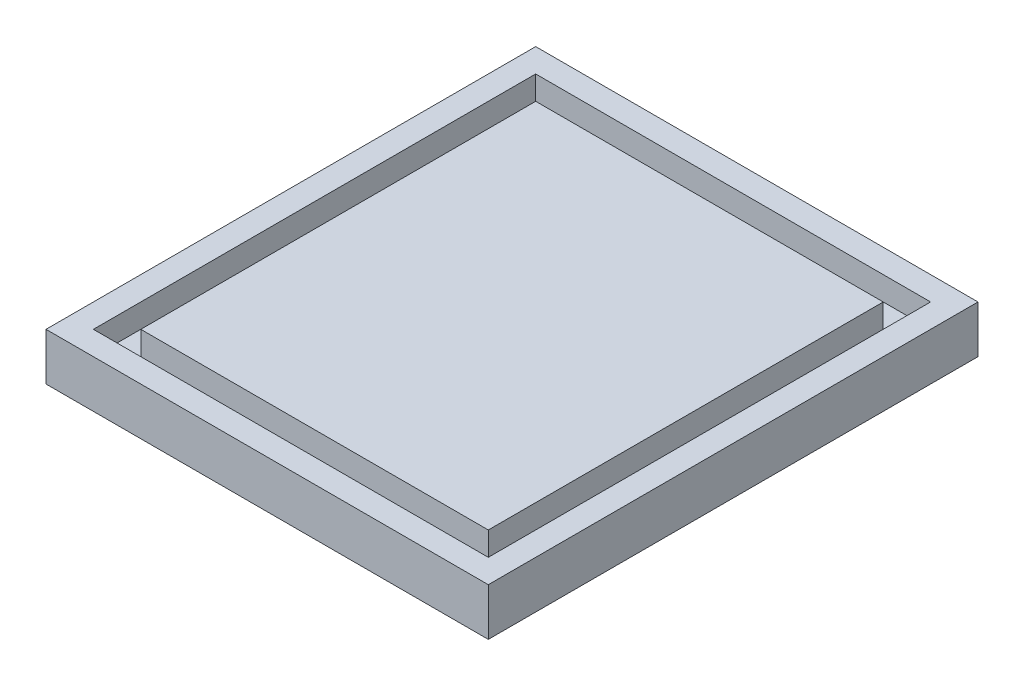
from build123d import *

# Parameters (mm, degrees)
SKETCH1_TURRETBODYPARENT_11_W   = 28
SKETCH1_TURRETBODYPARENT_11_H   = 31
BOSS_EXTRUDE1_DEPTH             = 1.5
SKETCH1_TURRETBODYPARENT_13_W   = 28
SKETCH1_TURRETBODYPARENT_13_H   = 31
SKETCH1_TURRETBODYPARENT_13_W_2 = 25
SKETCH1_TURRETBODYPARENT_13_H_2 = 28
SKETCH1_TURRETBODYPARENT_13_W_3 = 22
SKETCH1_TURRETBODYPARENT_13_H_3 = 25
BOSS_EXTRUDE2_DEPTH             = 1.5


with BuildPart() as part:
    # Sketch1-turretBodyParent<11> → Boss-Extrude1 (new body)
    with BuildSketch(Plane(origin=(0, 0, 0), x_dir=(1, 0, 0), z_dir=(0, 1, 0))):
        with Locations((9.5, 11)):
            Rectangle(SKETCH1_TURRETBODYPARENT_11_W, SKETCH1_TURRETBODYPARENT_11_H)
    extrude(amount=-BOSS_EXTRUDE1_DEPTH)

    # Sketch1-turretBodyParent<13> → Boss-Extrude2 (add)
    # profile 1 of 2: a face of its own
    with BuildSketch(Plane(origin=(0, 0, 0), x_dir=(1, 0, 0), z_dir=(0, 1, 0))):
        with Locations((9.5, 11)):
            Rectangle(SKETCH1_TURRETBODYPARENT_13_W, SKETCH1_TURRETBODYPARENT_13_H)
        with Locations((9.5, 11)):
            Rectangle(SKETCH1_TURRETBODYPARENT_13_W_2, SKETCH1_TURRETBODYPARENT_13_H_2, mode=Mode.SUBTRACT)
    # profile 2 of 2: a face of its own
    with BuildSketch(Plane(origin=(0, 0, 0), x_dir=(1, 0, 0), z_dir=(0, 1, 0))):
        with Locations((9.5, 11)):
            Rectangle(SKETCH1_TURRETBODYPARENT_13_W_3, SKETCH1_TURRETBODYPARENT_13_H_3)
    extrude(amount=BOSS_EXTRUDE2_DEPTH)


solid = part.part
